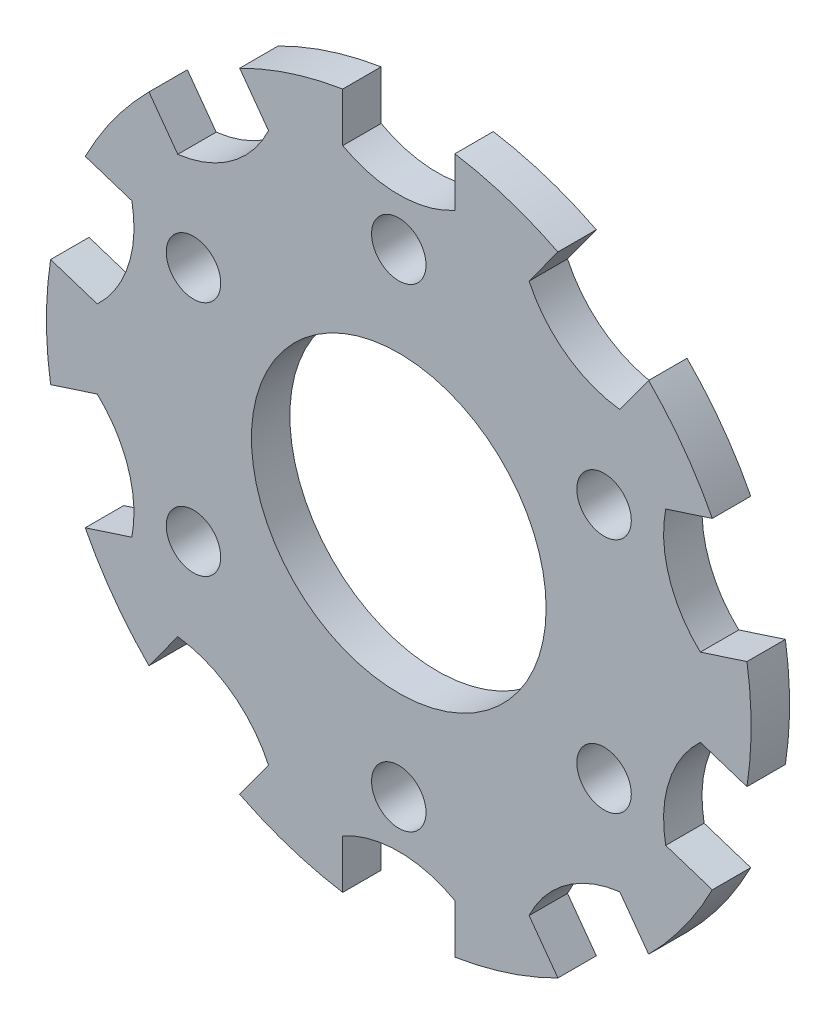
from build123d import *

# Parameters (mm, degrees)
SKETCH2_R           = 2.125
SKETCH2_R_2         = 11.5
BOSS_EXTRUDE2_DEPTH = 3


with BuildPart() as part:
    # Sketch2 → Boss-Extrude2 (new body)
    with BuildSketch(Plane.XY):
        with BuildLine():
            Line((-4.375, 23.324003444), (-4.375, 27.149758286))
            ThreePointArc((-4.375, 27.149758286), (-8.497967345, 26.154054198), (-12.418778174, 24.536176326))
            Line((-12.418778174, 24.536176326), (-10.170055898, 21.441075642))
            ThreePointArc((-10.170055898, 21.441075642), (-13.044413657, 17.954095121), (-17.248954599, 16.297954684))
            Line((-17.248954599, 16.297954684), (-19.497676874, 19.393055368))
            ThreePointArc((-19.497676874, 19.393055368), (-22.247967345, 16.164094438), (-24.469005184, 12.550608962))
            Line((-24.469005184, 12.550608962), (-20.830496111, 11.3683857))
            ThreePointArc((-20.830496111, 11.3683857), (-21.106304661, 6.857854099), (-23.534394812, 3.046641182))
            Line((-23.534394812, 3.046641182), (-27.172903884, 4.228864445))
            ThreePointArc((-27.172903884, 4.228864445), (-27.5, 0), (-27.172903884, -4.228864445))
            Line((-27.172903884, -4.228864445), (-23.534394812, -3.046641182))
            ThreePointArc((-23.534394812, -3.046641182), (-21.106304661, -6.857854099), (-20.830496111, -11.3683857))
            Line((-20.830496111, -11.3683857), (-24.469005184, -12.550608962))
            ThreePointArc((-24.469005184, -12.550608962), (-22.247967345, -16.164094438), (-19.497676874, -19.393055368))
            Line((-19.497676874, -19.393055368), (-17.248954599, -16.297954684))
            ThreePointArc((-17.248954599, -16.297954684), (-13.044413657, -17.954095121), (-10.170055898, -21.441075642))
            Line((-10.170055898, -21.441075642), (-12.418778174, -24.536176326))
            ThreePointArc((-12.418778174, -24.536176326), (-8.497967345, -26.154054198), (-4.375, -27.149758286))
            Line((-4.375, -27.149758286), (-4.375, -23.324003444))
            ThreePointArc((-4.375, -23.324003444), (0, -22.192482044), (4.375, -23.324003444))
            Line((4.375, -23.324003444), (4.375, -27.149758286))
            ThreePointArc((4.375, -27.149758286), (8.497967345, -26.154054198), (12.418778174, -24.536176326))
            Line((12.418778174, -24.536176326), (10.170055898, -21.441075642))
            ThreePointArc((10.170055898, -21.441075642), (13.044413657, -17.954095121), (17.248954599, -16.297954684))
            Line((17.248954599, -16.297954684), (19.497676874, -19.393055368))
            ThreePointArc((19.497676874, -19.393055368), (22.247967345, -16.164094438), (24.469005184, -12.550608962))
            Line((24.469005184, -12.550608962), (20.830496111, -11.3683857))
            ThreePointArc((20.830496111, -11.3683857), (21.106304661, -6.857854099), (23.534394812, -3.046641182))
            Line((23.534394812, -3.046641182), (27.172903884, -4.228864445))
            ThreePointArc((27.172903884, -4.228864445), (27.5, 0), (27.172903884, 4.228864445))
            Line((27.172903884, 4.228864445), (23.534394812, 3.046641182))
            ThreePointArc((23.534394812, 3.046641182), (21.106304661, 6.857854099), (20.830496111, 11.3683857))
            Line((20.830496111, 11.3683857), (24.469005184, 12.550608962))
            ThreePointArc((24.469005184, 12.550608962), (22.247967345, 16.164094438), (19.497676874, 19.393055368))
            Line((19.497676874, 19.393055368), (17.248954599, 16.297954684))
            ThreePointArc((17.248954599, 16.297954684), (13.044413657, 17.954095121), (10.170055898, 21.441075642))
            Line((10.170055898, 21.441075642), (12.418778174, 24.536176326))
            ThreePointArc((12.418778174, 24.536176326), (8.497967345, 26.154054198), (4.375, 27.149758286))
            Line((4.375, 27.149758286), (4.375, 23.324003444))
            ThreePointArc((4.375, 23.324003444), (0, 22.192482044), (-4.375, 23.324003444))
        make_face()
        with Locations((16.02146997, 9.25)):
            Circle(SKETCH2_R, mode=Mode.SUBTRACT)
        with Locations((0, 18.5)):
            Circle(SKETCH2_R, mode=Mode.SUBTRACT)
        with Locations((-16.02146997, 9.25)):
            Circle(SKETCH2_R, mode=Mode.SUBTRACT)
        with Locations((-16.02146997, -9.25)):
            Circle(SKETCH2_R, mode=Mode.SUBTRACT)
        with Locations((0, -18.5)):
            Circle(SKETCH2_R, mode=Mode.SUBTRACT)
        with Locations((16.02146997, -9.25)):
            Circle(SKETCH2_R, mode=Mode.SUBTRACT)
        Circle(SKETCH2_R_2, mode=Mode.SUBTRACT)
    extrude(amount=BOSS_EXTRUDE2_DEPTH)


solid = part.part
